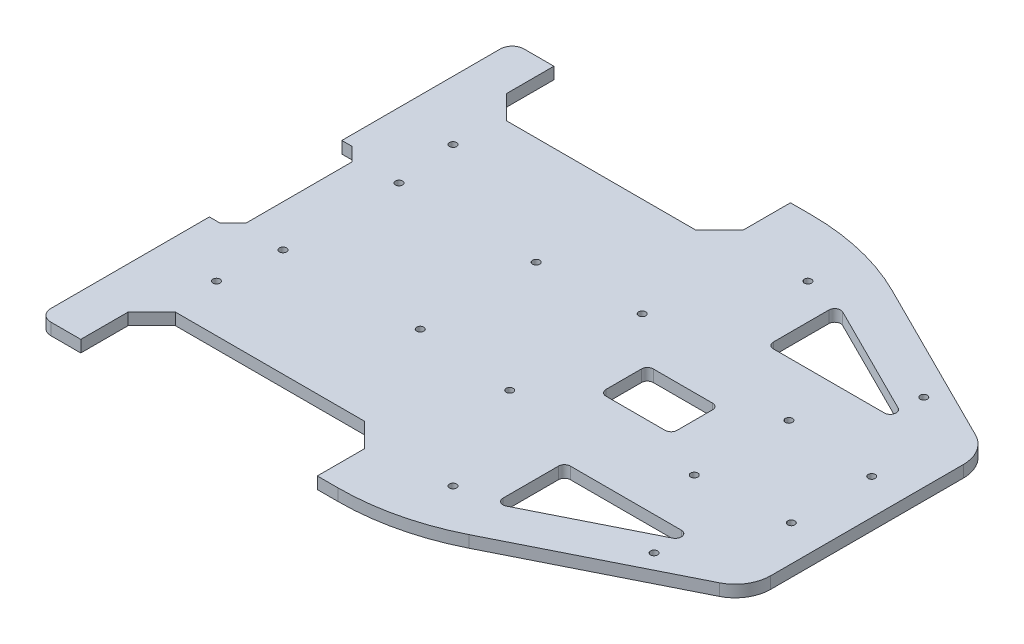
from build123d import *

# Parameters (mm, degrees)
BOSS_EXTRUDE2_DEPTH = 5
SKETCH7_R           = 1.5
CUT_EXTRUDE6_DEPTH  = 5
SKETCH2_R           = 1.5
CUT_EXTRUDE7_DEPTH  = 5
SKETCH4_R           = 1.5
CUT_EXTRUDE8_DEPTH  = 5
SKETCH10_R          = 1.5
CUT_EXTRUDE9_DEPTH  = 5
CUT_EXTRUDE10_DEPTH = 5
SKETCH15_R          = 1.5
CUT_EXTRUDE11_DEPTH = 161.15617378
CUT_EXTRUDE12_DEPTH = 5


with BuildPart() as part:
    # Sketch1 → Boss-Extrude2 (new body)
    with BuildSketch(Plane(origin=(0, 0, 0), x_dir=(1, 0, 0), z_dir=(0, 1, 0))):
        with BuildLine():
            Line((-120, 100), (-107.361996995, 100))
            Line((-107.361996995, 100), (-107.361996995, 80))
            Line((-107.361996995, 80), (-97.361996995, 70))
            Line((-97.361996995, 70), (-17.361996995, 70))
            Line((-17.361996995, 70), (-7.361996995, 80))
            Line((-7.361996995, 80), (-7.361996995, 100))
            Line((-7.361996995, 100), (1.39320225, 100))
            ThreePointArc((1.39320225, 100), (24.368494305, 97.324898947), (46.1145618, 89.4427191))
            Line((46.1145618, 89.4427191), (116.708203932, 54.145898034))
            ThreePointArc((116.708203932, 54.145898034), (122.759762125, 48.615456851), (125, 40.729490169))
            Line((125, 40.729490169), (125, -40.729490169))
            ThreePointArc((125, -40.729490169), (122.759762125, -48.615456851), (116.708203932, -54.145898034))
            Line((116.708203932, -54.145898034), (46.1145618, -89.4427191))
            ThreePointArc((46.1145618, -89.4427191), (24.368494305, -97.324898947), (1.39320225, -100))
            Line((1.39320225, -100), (-7.361996995, -100))
            Line((-7.361996995, -100), (-7.361996995, -80))
            Line((-7.361996995, -80), (-17.361996995, -70))
            Line((-17.361996995, -70), (-97.361996995, -70))
            Line((-97.361996995, -70), (-107.361996995, -80))
            Line((-107.361996995, -80), (-107.361996995, -100))
            Line((-107.361996995, -100), (-120, -100))
            ThreePointArc((-120, -100), (-123.535533906, -98.535533906), (-125, -95))
            Line((-125, -95), (-125, 95))
            ThreePointArc((-125, 95), (-123.535533906, 98.535533906), (-120, 100))
        make_face()
    extrude(amount=-BOSS_EXTRUDE2_DEPTH)

    # Sketch7 → Cut-Extrude6 (cut)
    with BuildSketch(Plane(origin=(0, 0, 0), x_dir=(1, 0, 0), z_dir=(0, 1, 0))):
        with Locations(Location((1.966861521, 27.998221343, 0), (0, 0, 270))):
            Circle(SKETCH7_R)
        with Locations(Location((71.966861521, 20.005897242, 0), (0, 0, 270))):
            Circle(SKETCH7_R)
        with Locations(Location((1.966861521, -28.001778657, 0), (0, 0, 270))):
            Circle(SKETCH7_R)
        with Locations(Location((71.966861521, -19.994102758, 0), (0, 0, 270))):
            Circle(SKETCH7_R)
        with BuildLine():
            Line((24.466861521, 10.195064991), (49.466861521, 10.195064991))
            ThreePointArc((49.466861521, 10.195064991), (51.234628473, 9.462831944), (51.966861521, 7.695064991))
            Line((51.966861521, 7.695064991), (51.966861521, -7.304935009))
            ThreePointArc((51.966861521, -7.304935009), (51.234628473, -9.072701962), (49.466861521, -9.804935009))
            Line((49.466861521, -9.804935009), (24.466861521, -9.804935009))
            ThreePointArc((24.466861521, -9.804935009), (22.699094568, -9.072701962), (21.966861521, -7.304935009))
            Line((21.966861521, -7.304935009), (21.966861521, 7.695064991))
            ThreePointArc((21.966861521, 7.695064991), (22.699094568, 9.462831944), (24.466861521, 10.195064991))
        make_face()
    extrude(amount=-CUT_EXTRUDE6_DEPTH, mode=Mode.SUBTRACT)

    # Sketch2 → Cut-Extrude7 (cut)
    with BuildSketch(Plane(origin=(0, 0, 0), x_dir=(1, 0, 0), z_dir=(0, 1, 0))):
        with Locations(Location((110, 17, 0), (0, 0, 270))):
            Circle(SKETCH2_R)
        with Locations(Location((110, -17, 0), (0, 0, 270))):
            Circle(SKETCH2_R)
    extrude(amount=-CUT_EXTRUDE7_DEPTH, mode=Mode.SUBTRACT)

    # Sketch4 → Cut-Extrude8 (cut)
    with BuildSketch(Plane(origin=(0, 0, 0), x_dir=(1, 0, 0), z_dir=(0, 1, 0))):
        with Locations(Location((-97.352664983, -24.5, 0), (0, 0, 270))):
            Circle(SKETCH4_R)
        with Locations(Location((-39.352664983, 24.5, 0), (0, 0, 270))):
            Circle(SKETCH4_R)
        with Locations(Location((-97.352664983, 24.5, 0), (0, 0, 270))):
            Circle(SKETCH4_R)
        with Locations(Location((-39.352664983, -24.5, 0), (0, 0, 270))):
            Circle(SKETCH4_R)
    extrude(amount=-CUT_EXTRUDE8_DEPTH, mode=Mode.SUBTRACT)

    # Sketch10 → Cut-Extrude9 (cut)
    with BuildSketch(Plane(origin=(0, 0, 0), x_dir=(1, 0, 0), z_dir=(0, 1, 0))):
        with Locations(Location((-100, 50.00070964, 0), (0, 0, 270))):
            Circle(SKETCH10_R)
        with Locations(Location((-100, -49.99929036, 0), (0, 0, 270))):
            Circle(SKETCH10_R)
        with Locations(Location((25, 75.00070964, 0), (0, 0, 270))):
            Circle(SKETCH10_R)
        with Locations(Location((25, -74.99929036, 0), (0, 0, 270))):
            Circle(SKETCH10_R)
    extrude(amount=-CUT_EXTRUDE9_DEPTH, mode=Mode.SUBTRACT)

    # Sketch11 → Cut-Extrude10 (cut)
    with BuildSketch(Plane(origin=(0, 0, 0), x_dir=(1, 0, 0), z_dir=(0, 1, 0))):
        with BuildLine():
            Line((43.618033989, 71.094545302), (90.527864045, 47.639630274))
            ThreePointArc((90.527864045, 47.639630274), (91.84295253, 44.829179995), (89.409830056, 42.903562297))
            Line((89.409830056, 42.903562297), (42.5, 42.903562297))
            ThreePointArc((42.5, 42.903562297), (40.732233047, 43.635795344), (40, 45.403562297))
            Line((40, 45.403562297), (40, 68.858477325))
            ThreePointArc((40, 68.858477325), (41.18567222, 70.985104346), (43.618033989, 71.094545302))
        make_face()
        with BuildLine():
            Line((40, -68.858477325), (40, -45.403562297))
            ThreePointArc((40, -45.403562297), (40.732233047, -43.635795344), (42.5, -42.903562297))
            Line((42.5, -42.903562297), (89.409830056, -42.903562297))
            ThreePointArc((89.409830056, -42.903562297), (91.84295253, -44.829179995), (90.527864045, -47.639630274))
            Line((90.527864045, -47.639630274), (43.618033989, -71.094545302))
            ThreePointArc((43.618033989, -71.094545302), (41.18567222, -70.985104346), (40, -68.858477325))
        make_face()
    extrude(amount=-CUT_EXTRUDE10_DEPTH, mode=Mode.SUBTRACT)

    # Sketch15 → Cut-Extrude11 (cut, through all)
    with BuildSketch(Plane(origin=(0, 0, 0), x_dir=(1, 0, 0), z_dir=(0, 1, 0))):
        with Locations(Location((92, 56.996711096, 0), (0, 0, 270))):
            Circle(SKETCH15_R)
        with Locations(Location((92, -56.996711096, 0), (0, 0, 90))):
            Circle(SKETCH15_R)
    extrude(amount=-CUT_EXTRUDE11_DEPTH, mode=Mode.SUBTRACT)

    # Sketch16 → Cut-Extrude12 (cut)
    with BuildSketch(Plane(origin=(0, 0, 0), x_dir=(1, 0, 0), z_dir=(0, 1, 0))):
        Polygon((-125, 28), (-120.6, 28), (-115, 22.4), (-115, -22.4), (-120.6, -28), (-125, -28), align=None)
    extrude(amount=-CUT_EXTRUDE12_DEPTH, mode=Mode.SUBTRACT)


solid = part.part
